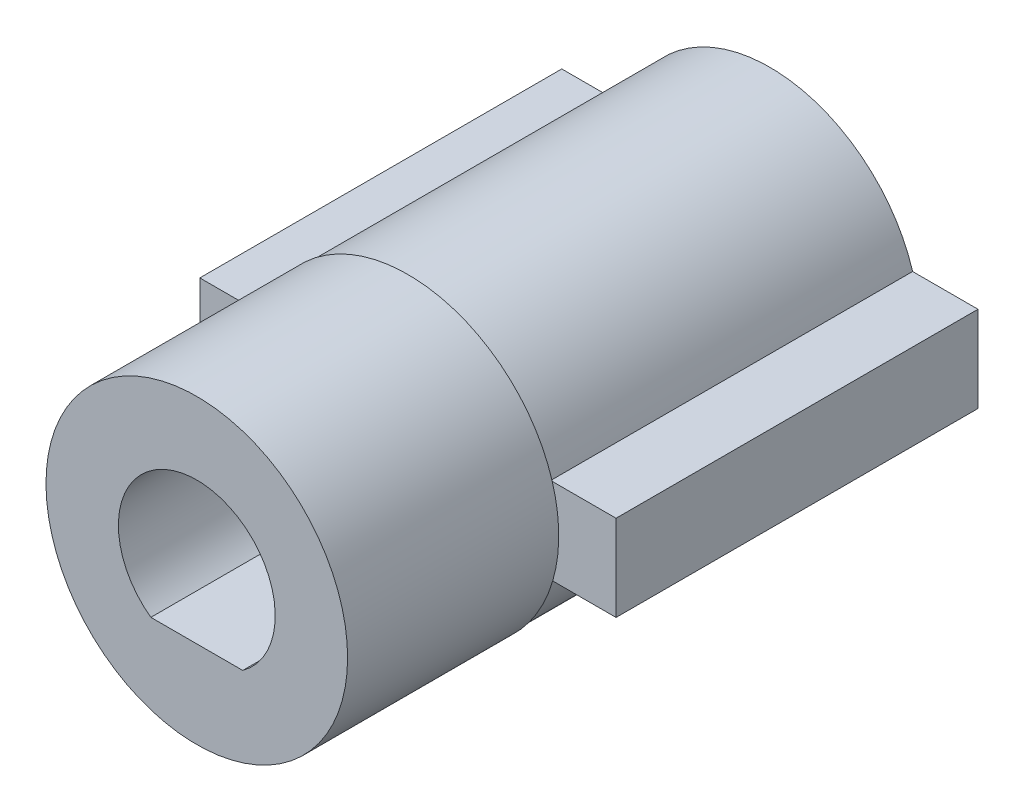
from build123d import *

# Parameters (mm, degrees)
Y_KSEKLIK_EKSTR_ZYON1_DEPTH = 12
IZIM3_R                     = 5
Y_KSEKLIK_EKSTR_ZYON3_DEPTH = 7
IZIM2_R                     = 2.701874654
IZIM2_R_2                   = 1.49
Y_KSEKLIK_EKSTR_ZYON2_DEPTH = 8


with BuildPart() as part:
    # Çizim1 → Yükseklik-Ekstrüzyon1 (new body)
    with BuildSketch(Plane.XY):
        with BuildLine():
            Line((4.73249152, 1.451214667), (6.9, 1.451214667))
            Line((6.9, 1.451214667), (6.9, -1.398785333))
            Line((6.9, -1.398785333), (4.748252267, -1.398785333))
            ThreePointArc((4.748252267, -1.398785333), (0, -4.95), (-4.748252267, -1.398785333))
            Line((-4.748252267, -1.398785333), (-6.9, -1.398785333))
            Line((-6.9, -1.398785333), (-6.9, 1.451214667))
            Line((-6.9, 1.451214667), (-4.73249152, 1.451214667))
            ThreePointArc((-4.73249152, 1.451214667), (0, 4.95), (4.73249152, 1.451214667))
        make_face()
        with BuildLine():
            Line((1.523723566, -2.106719368), (-1.523723566, -2.106719368))
            ThreePointArc((-1.523723566, -2.106719368), (0, 2.6), (1.523723566, -2.106719368))
        make_face(mode=Mode.SUBTRACT)
    extrude(amount=Y_KSEKLIK_EKSTR_ZYON1_DEPTH)

    # Çizim3 → Yükseklik-Ekstrüzyon3 (add)
    with BuildSketch(Plane.XY.offset(12)):
        with Locations(Location((0, 0, 0), (0, 0, 196.245706225))):
            Circle(IZIM3_R)
        with BuildLine():
            Line((-1.523723566, -2.106719368), (1.523723566, -2.106719368))
            ThreePointArc((1.523723566, -2.106719368), (0, 2.6), (-1.523723566, -2.106719368))
        make_face(mode=Mode.SUBTRACT)
    extrude(amount=Y_KSEKLIK_EKSTR_ZYON3_DEPTH)

    # Çizim2 → Yükseklik-Ekstrüzyon2 (add)
    with BuildSketch(Plane.XY):
        Circle(IZIM2_R)
        Circle(IZIM2_R_2, mode=Mode.SUBTRACT)
    extrude(amount=Y_KSEKLIK_EKSTR_ZYON2_DEPTH)


solid = part.part
